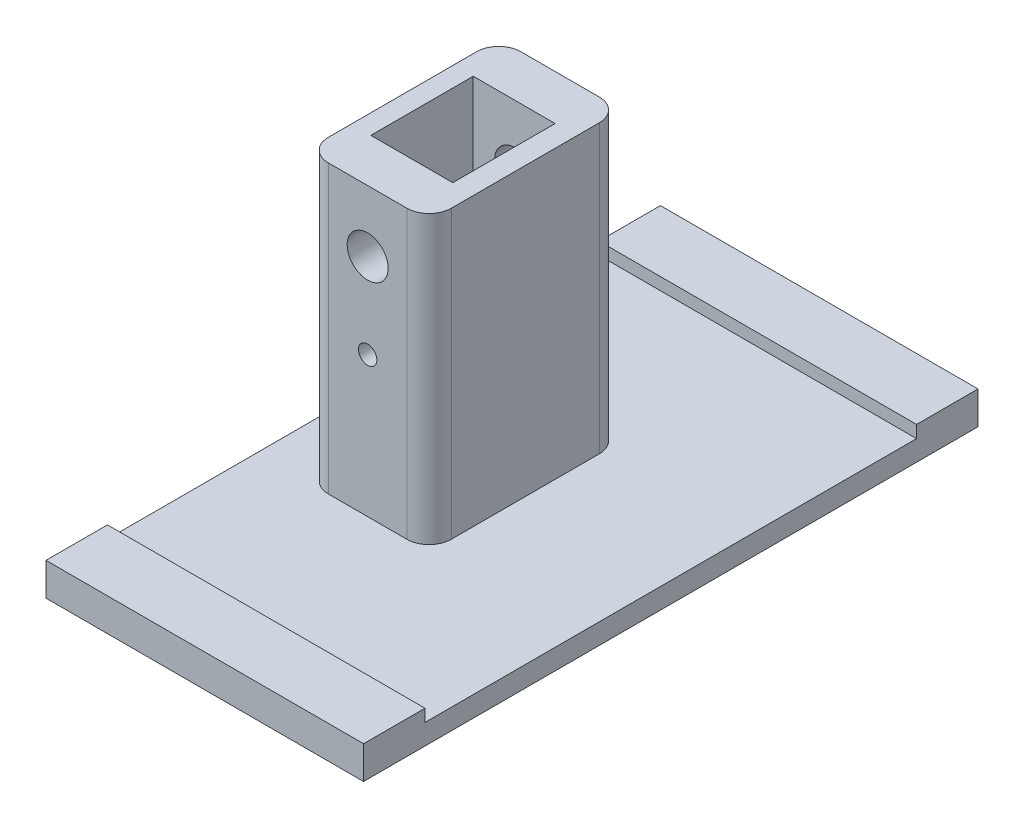
from build123d import *

# Parameters (mm, degrees)
SKETCH2_W             = 39.3827
SKETCH2_H             = 7.62
BOSS_EXTRUDE2_DEPTH   = 4.064
BOSS_EXTRUDE2_2_DEPTH = 4.064
BOSS_EXTRUDE3_DEPTH   = 2.54
BOSS_EXTRUDE4_DEPTH   = 38.1
SKETCH4_W             = 10.16
SKETCH4_H             = 3.81
CUT_EXTRUDE2_DEPTH    = 12.7
CUT_EXTRUDE3_REACH    = 76.205
SKETCH5_R             = 2.54
SKETCH5_R_2           = 1.143
CUT_EXTRUDE5_DEPTH    = 35.56


with BuildPart() as part:
    # Sketch2 → Boss-Extrude2 (new body)
    with BuildSketch(Plane(origin=(0, 0, 0), x_dir=(1, 0, 0), z_dir=(0, 1, 0))):
        with Locations((19.69135, 3.81)):
            Rectangle(SKETCH2_W, SKETCH2_H)
    extrude(amount=BOSS_EXTRUDE2_DEPTH)



with BuildPart() as body_2:
    # Sketch2 → Boss-Extrude2 2 (new body)
    with BuildSketch(Plane(origin=(0, 0, 0), x_dir=(1, 0, 0), z_dir=(0, 1, 0))):
        with Locations((19.69135, 72.39)):
            Rectangle(SKETCH2_W, SKETCH2_H)
    extrude(amount=BOSS_EXTRUDE2_2_DEPTH)


with BuildPart() as part_1:
    add(part.part)

    add(body_2.part)  # Boss-Extrude3 merges body 2
    # Sketch2<3> → Boss-Extrude3 (add)
    with BuildSketch(Plane(origin=(0, 0, 0), x_dir=(1, 0, 0), z_dir=(0, 1, 0))):
        with BuildLine():
            Line((0, 34.29), (0, 7.62))
            Line((0, 7.62), (39.3827, 7.62))
            Line((39.3827, 7.62), (39.3827, 68.58))
            Line((39.3827, 68.58), (0, 68.58))
            Line((0, 68.58), (0, 41.91))
            ThreePointArc((0, 41.91), (3.81, 38.1), (0, 34.29))
        make_face()
    extrude(amount=BOSS_EXTRUDE3_DEPTH)

    # Sketch2<8> → Boss-Extrude4 (add)
    with BuildSketch(Plane(origin=(0, 0, 0), x_dir=(1, 0, 0), z_dir=(0, 1, 0))):
        Polygon((6.107856951, 50.038), (6.107856951, 38.1), (6.107856951, 26.162), (21.347856951, 26.162), (21.347856951, 50.038), align=None)
        Polygon((8.533414456, 31.75), (8.533414456, 38.1), (8.533414456, 44.45), (18.693414456, 44.45), (18.693414456, 31.75), align=None, mode=Mode.SUBTRACT)
    extrude(amount=BOSS_EXTRUDE4_DEPTH)

    # Sketch4 → Cut-Extrude2 (cut)
    with BuildSketch(Plane(origin=(0, 2.54, 0), x_dir=(1, 0, 0), z_dir=(0, 1, 0))):
        with Locations((13.613414456, 46.355)):
            Rectangle(SKETCH4_W, SKETCH4_H)
        with Locations((13.613414456, 29.845)):
            Rectangle(SKETCH4_W, SKETCH4_H)
    extrude(amount=CUT_EXTRUDE2_DEPTH, mode=Mode.SUBTRACT)

    # Cut-Extrude3: up to this face of the body (flat: up to its plane)
    cut_extrude3_end = Plane(part_1.part.faces().sort_by_distance((13.727856951, 20.32, -26.162))[0])
    # Sketch5 → Cut-Extrude3 (cut, up to the picked face)
    with BuildSketch(Plane(origin=(0, 0, -50.038), x_dir=(-1, 0, 0), z_dir=(0, 0, -1)), mode=Mode.PRIVATE) as cut_extrude3_sk1:
        with Locations((-13.727856951, 30.48)):
            Circle(SKETCH5_R)
    cut_extrude3_tool1 = split(extrude(cut_extrude3_sk1.sketch, amount=-CUT_EXTRUDE3_REACH, mode=Mode.PRIVATE), bisect_by=cut_extrude3_end, keep=Keep.BOTH, mode=Mode.PRIVATE)
    # Sketch5 → Cut-Extrude3 (cut, up to the picked face)
    with BuildSketch(Plane(origin=(0, 0, -50.038), x_dir=(-1, 0, 0), z_dir=(0, 0, -1)), mode=Mode.PRIVATE) as cut_extrude3_sk2:
        with Locations((-13.727856951, 19.939)):
            Circle(SKETCH5_R_2)
    cut_extrude3_tool2 = split(extrude(cut_extrude3_sk2.sketch, amount=-CUT_EXTRUDE3_REACH, mode=Mode.PRIVATE), bisect_by=cut_extrude3_end, keep=Keep.BOTH, mode=Mode.PRIVATE)
    add(cut_extrude3_tool1.solids().sort_by(Axis((13.727857, 30.48, -50.038), (0, 0, 1)))[0], mode=Mode.SUBTRACT)
    add(cut_extrude3_tool2.solids().sort_by(Axis((13.727857, 19.939, -50.038), (0, 0, 1)))[0], mode=Mode.SUBTRACT)

    # Sketch6 → Cut-Extrude5 (cut)
    with BuildSketch(Plane(origin=(0, 38.1, 0), x_dir=(1, 0, 0), z_dir=(0, 1, 0))):
        with BuildLine():
            ThreePointArc((6.107856951, 47.286333333), (6.913801458, 49.232055493), (8.859523617, 50.038))
            Line((8.859523617, 50.038), (6.107856951, 50.038))
            Line((6.107856951, 50.038), (6.107856951, 47.286333333))
        make_face()
        with BuildLine():
            ThreePointArc((18.596190284, 50.038), (20.541912444, 49.232055493), (21.347856951, 47.286333333))
            Line((21.347856951, 47.286333333), (21.347856951, 50.038))
            Line((21.347856951, 50.038), (18.596190284, 50.038))
        make_face()
        with BuildLine():
            Line((6.107856951, 26.162), (8.859523617, 26.162))
            ThreePointArc((8.859523617, 26.162), (6.913801458, 26.967944507), (6.107856951, 28.913666667))
            Line((6.107856951, 28.913666667), (6.107856951, 26.162))
        make_face()
        with BuildLine():
            Line((21.347856951, 26.162), (21.347856951, 28.913666667))
            ThreePointArc((21.347856951, 28.913666667), (20.541912444, 26.967944507), (18.596190284, 26.162))
            Line((18.596190284, 26.162), (21.347856951, 26.162))
        make_face()
    extrude(amount=-CUT_EXTRUDE5_DEPTH, mode=Mode.SUBTRACT)


solid = part_1.part
